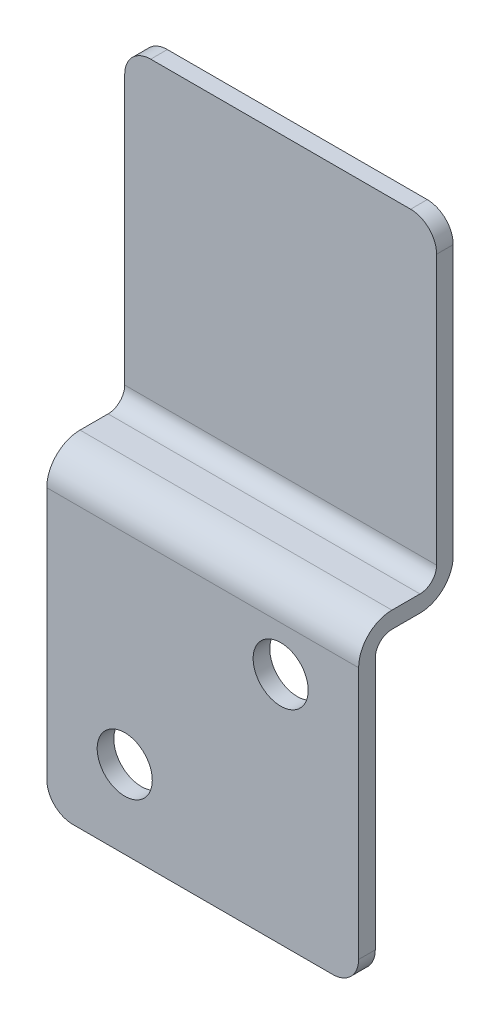
from build123d import *

# Parameters (mm, degrees)
BOSS_EXTRUDE1_DEPTH = 38.1
FILLET1_R           = 2.032
FILLET2_R           = 4.064
FILLET3_R           = 3.175
SKETCH2_R           = 3.3655
CUT_EXTRUDE1_DEPTH  = 86.974497666


with BuildPart() as part:
    # Sketch1 → Boss-Extrude1 (new body)
    with BuildSketch(Plane(origin=(0, 0, 0), x_dir=(0, 0, -1), z_dir=(1, 0, 0))):
        Polygon((0, 0), (0, -38.1), (-9.525, -38.1), (-9.525, -76.2), (-7.493, -76.2), (-7.493, -40.132), (2.032, -40.132), (2.032, 0), align=None)
    extrude(amount=BOSS_EXTRUDE1_DEPTH)

    # Fillet1
    fillet1_edges = [part.edges().sort_by_distance(p)[0] for p in [
        (19.05, -40.132, 7.493),
        (19.05, -38.1, 0),
    ]]
    fillet(fillet1_edges, radius=FILLET1_R)

    # Fillet2
    fillet2_edges = [part.edges().sort_by_distance(p)[0] for p in [
        (19.05, -40.132, -2.032),
        (19.05, -38.1, 9.525),
    ]]
    fillet(fillet2_edges, radius=FILLET2_R)

    # Fillet3
    fillet3_edges = [part.edges().sort_by_distance(p)[0] for p in [
        (0, 0, -1.016),
        (38.1, -76.2, 8.509),
        (38.1, 0, -1.016),
        (0, -76.2, 8.509),
    ]]
    fillet(fillet3_edges, radius=FILLET3_R)

    # Sketch2 → Cut-Extrude1 (cut, through all)
    with BuildSketch(Plane.XY.offset(9.525)):
        with Locations((9.525, -66.675)):
            Circle(SKETCH2_R)
        with Locations((28.575, -47.625)):
            Circle(SKETCH2_R)
    extrude(amount=-CUT_EXTRUDE1_DEPTH, mode=Mode.SUBTRACT)


solid = part.part
